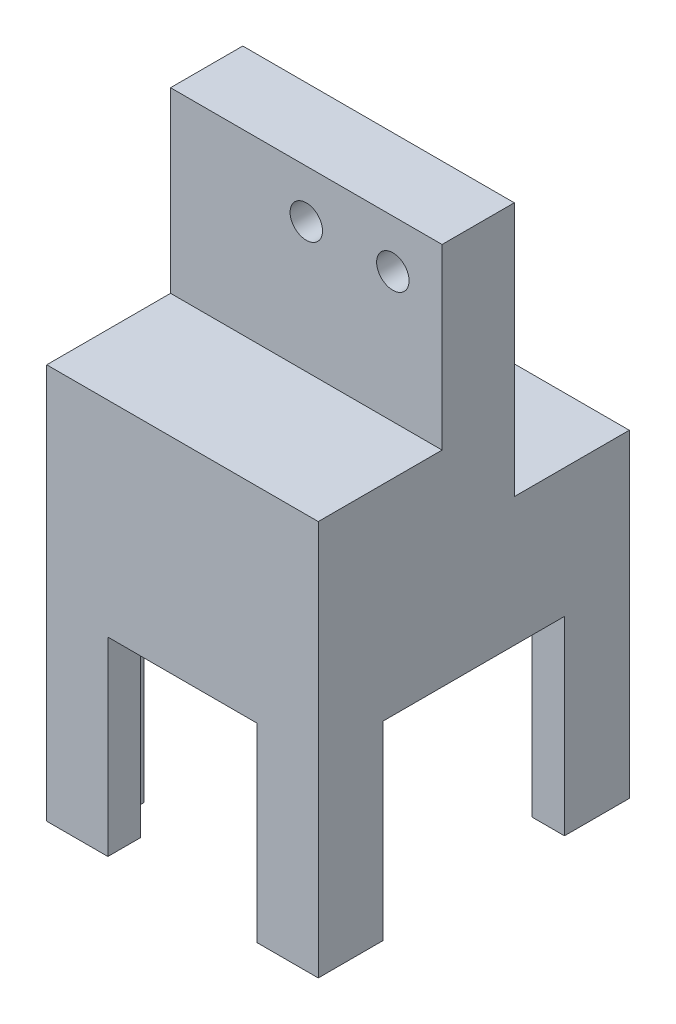
from build123d import *

# Parameters (mm, degrees)
SKETCH4_W           = 25.1
SKETCH4_H           = 28.75
BOSS_EXTRUDE2_DEPTH = 53
SKETCH5_W           = 19.1
SKETCH5_H           = 22.75
CUT_EXTRUDE1_DEPTH  = 21.67
FILLET1_R           = 4.1
SKETCH6_W           = 2.88
SKETCH6_H           = 5.1
CUT_EXTRUDE2_DEPTH  = 4.67
SKETCH7_W           = 16.769550268
SKETCH7_H           = 35.14
CUT_EXTRUDE3_DEPTH  = 40
SKETCH8_W           = 13.798322684
SKETCH8_H           = 35.14
CUT_EXTRUDE4_DEPTH  = 40
SKETCH9_W           = 8.5
SKETCH9_H           = 16.46
CUT_EXTRUDE5_DEPTH  = 40
SKETCH10_W          = 10.629287706
SKETCH10_H          = 23.523496481
CUT_EXTRUDE6_DEPTH  = 40
SKETCH11_W          = 25.1
SKETCH11_H          = 2.9448388
CUT_EXTRUDE7_DEPTH  = 16.46
SKETCH16_R          = 1.5
CUT_EXTRUDE8_DEPTH  = 10


with BuildPart() as part:
    # Sketch4 → Boss-Extrude2 (new body)
    with BuildSketch(Plane(origin=(0, 0, 0), x_dir=(1, 0, 0), z_dir=(0, 1, 0))):
        Rectangle(SKETCH4_W, SKETCH4_H)
    extrude(amount=BOSS_EXTRUDE2_DEPTH)

    # Sketch5 → Cut-Extrude1 (cut)
    with BuildSketch(Plane(origin=(0, 0, 0), x_dir=(-1, 0, 0), z_dir=(0, -1, 0))):
        Rectangle(SKETCH5_W, SKETCH5_H)
    extrude(amount=-CUT_EXTRUDE1_DEPTH, mode=Mode.SUBTRACT)

    # Fillet1
    fillet1_edges = [part.edges().sort_by_distance(p)[0] for p in [
        (0, 21.67, -11.375),
        (0, 21.67, 11.375),
    ]]
    fillet(fillet1_edges, radius=FILLET1_R)

    # Sketch6 → Cut-Extrude2 (cut)
    with BuildSketch(Plane(origin=(0, 21.67, 0), x_dir=(-1, 0, 0), z_dir=(0, -1, 0))):
        Rectangle(SKETCH6_W, SKETCH6_H)
    extrude(amount=-CUT_EXTRUDE2_DEPTH, mode=Mode.SUBTRACT)

    # Sketch7 → Cut-Extrude3 (cut)
    with BuildSketch(Plane(origin=(12.55, 0, 0), x_dir=(0, 0, -1), z_dir=(1, 0, 0))):
        Rectangle(SKETCH7_W, SKETCH7_H)
    extrude(amount=-CUT_EXTRUDE3_DEPTH, mode=Mode.SUBTRACT)

    # Sketch8 → Cut-Extrude4 (cut)
    with BuildSketch(Plane(origin=(0, 0, -14.375), x_dir=(-1, 0, 0), z_dir=(0, 0, -1))):
        Rectangle(SKETCH8_W, SKETCH8_H)
    extrude(amount=-CUT_EXTRUDE4_DEPTH, mode=Mode.SUBTRACT)

    # Sketch9 → Cut-Extrude5 (cut)
    with BuildSketch(Plane.ZY.offset(12.55)):
        with Locations((10.125, 44.77)):
            Rectangle(SKETCH9_W, SKETCH9_H)
    extrude(amount=-CUT_EXTRUDE5_DEPTH, mode=Mode.SUBTRACT)

    # Sketch10 → Cut-Extrude6 (cut)
    with BuildSketch(Plane.ZY.offset(12.55)):
        with Locations((-9.060356147, 41.23825176)):
            Rectangle(SKETCH10_W, SKETCH10_H)
    extrude(amount=-CUT_EXTRUDE6_DEPTH, mode=Mode.SUBTRACT)

    # Sketch11 → Cut-Extrude7 (cut)
    with BuildSketch(Plane(origin=(0, 53, 0), x_dir=(1, 0, 0), z_dir=(0, 1, 0))):
        with Locations((0, -4.4025806)):
            Rectangle(SKETCH11_W, SKETCH11_H)
    extrude(amount=-CUT_EXTRUDE7_DEPTH, mode=Mode.SUBTRACT)

    # Sketch16 → Cut-Extrude8 (cut)
    with BuildSketch(Plane.XY.offset(2.9301612)):
        with Locations((0, 48.560139002)):
            Circle(SKETCH16_R)
        with Locations((8, 48.560139002)):
            Circle(SKETCH16_R)
    extrude(amount=-CUT_EXTRUDE8_DEPTH, mode=Mode.SUBTRACT)


solid = part.part
